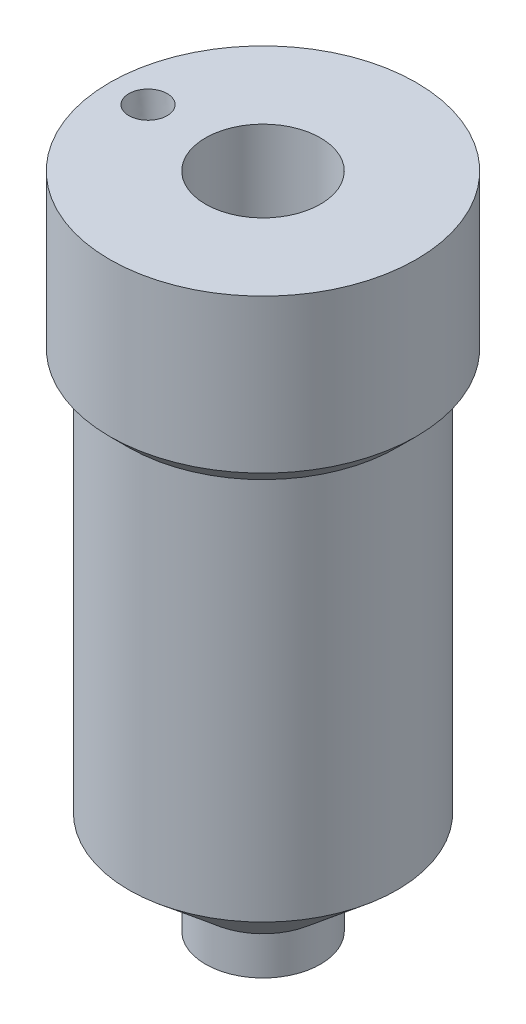
from build123d import *

# Parameters (mm, degrees)
SKETCH3_R         = 1
SKETCH8_W         = 0.07
SKETCH8_H         = 0.35
CIRPATTERN2_COUNT = 14
CIRPATTERN3_COUNT = 12
CIRPATTERN4_COUNT = 6


with BuildPart() as part:
    # Sketch1 → Revolve1 (revolve)
    with BuildSketch(Plane.XY, mode=Mode.PRIVATE) as revolve1_sk:
        with BuildLine():
            Line((3, -1.968555634), (3, 21.031444366))
            Line((3, 21.031444366), (8, 21.031444366))
            Line((8, 21.031444366), (8, 13.031444366))
            Line((8, 13.031444366), (7, 12.031444366))
            Line((7, 12.031444366), (7, -7.968555634))
            Line((7, -7.968555634), (3, -11.324954159))
            Line((3, -11.324954159), (3, -13.324954159))
            Line((3, -13.324954159), (0.5, -14.768329832))
            Line((0.5, -14.768329832), (0.5, -9.868329832))
            ThreePointArc((0.5, -9.868329832), (0.652240935, -9.102962967), (1.085786438, -8.454116269))
            add(Edge.make_bspline(
                [(1.085786438, -8.454116269), (5.800555296, -3.73934741), (7.549181555, -1.968555634), (3, -1.968555634)],
                knots=[0.03799373, 0.03799373, 0.03799373, 0.03799373, 1, 1, 1, 1], degree=3))
        make_face()
    revolve(revolve1_sk.sketch.rotate(Axis((0, 26.545479362, 0), (0, -1, 0)), 90), axis=Axis((0, 26.545479362, 0), (0, -1, 0)))

    # Cut-Sweep1: sweep along a path in Sketch2
    with BuildLine(Plane.XY) as cut_sweep1_path:
        Line((-6, 21.031444366), (-4.6, -2.971908367))
    # Sketch3 → Cut-Sweep1 (sweep, cut)
    with BuildSketch(Plane(origin=(0, 21.031444366, 0), x_dir=(1, 0, 0), z_dir=(0, 1, 0))):
        with Locations((-6, 0)):
            Circle(SKETCH3_R)
    sweep(path=cut_sweep1_path.line, mode=Mode.SUBTRACT)

    # Sketch4 → Revolve2 (revolve)
    with BuildSketch(Plane.XY, mode=Mode.PRIVATE) as revolve2_sk:
        with BuildLine():
            ThreePointArc((0, -15.168329832), (0.282842712, -15.051172544), (0.4, -14.768329832))
            Line((0.4, -14.768329832), (0.5, -14.668329832))
            Line((0.5, -14.668329832), (0.5, -14.768329832))
            ThreePointArc((0.5, -14.768329832), (0.353553391, -15.121883222), (0, -15.268329832))
            Line((0, -15.268329832), (0, -15.168329832))
        make_face()
    revolve(revolve2_sk.sketch.rotate(Axis((0, -14.768329832, 0), (0, -1, 0)), 90), axis=Axis((0, -14.768329832, 0), (0, -1, 0)))

    # Sketch5 → Cut-Revolve2 (revolve, cut)
    with BuildSketch(Plane.XY, mode=Mode.PRIVATE) as cut_revolve2_sk:
        Polygon((-0.341224769, -14.846212159), (-0.682449539, -14.924094485), (-0.666873073, -14.992339439), (-0.325648304, -14.914457112), align=None)
    cut_revolve2 = revolve(cut_revolve2_sk.sketch.rotate(Axis((-0.341224769, -14.846212159, 0), (-0.9749279121818248, -0.22252093395630929, 0)), 180), axis=Axis((-0.341224769, -14.846212159, 0), (-0.9749279121818248, -0.22252093395630929, 0)), mode=Mode.SUBTRACT)

    # Sketch6 → Cut-Revolve3 (revolve, cut)
    with BuildSketch(Plane.XY, mode=Mode.PRIVATE) as cut_revolve3_sk:
        Polygon((-0.547282038, -15.204772693), (-0.503637752, -15.259500897), (-0.229996733, -15.041279466), (-0.273641019, -14.986551262), align=None)
    cut_revolve3 = revolve(cut_revolve3_sk.sketch.rotate(Axis((-0.273641019, -14.986551262, 0), (-0.781831482468034, -0.6234898018587284, 0)), 180), axis=Axis((-0.273641019, -14.986551262, 0), (-0.781831482468034, -0.6234898018587284, 0)), mode=Mode.SUBTRACT)

    # Sketch7 → Cut-Revolve4 (revolve, cut)
    with BuildSketch(Plane.XY, mode=Mode.PRIVATE) as cut_revolve4_sk:
        Polygon((-0.303718617, -15.399008039), (-0.240650797, -15.429379901), (-0.088791488, -15.114040797), (-0.151859309, -15.083668935), align=None)
    cut_revolve4 = revolve(cut_revolve4_sk.sketch.rotate(Axis((-0.151859309, -15.083668935, 0), (-0.43388373911756084, -0.9009688679024179, 0)), 180), axis=Axis((-0.151859309, -15.083668935, 0), (-0.43388373911756084, -0.9009688679024179, 0)), mode=Mode.SUBTRACT)

    # Sketch8 → Cut-Revolve5 (revolve, cut)
    with BuildSketch(Plane.XY, mode=Mode.PRIVATE) as cut_revolve5_sk:
        with Locations((0.035, -15.293329832)):
            Rectangle(SKETCH8_W, SKETCH8_H)
    revolve(cut_revolve5_sk.sketch.rotate(Axis((0, -15.118329832, 0), (0, -1, 0)), 90), axis=Axis((0, -15.118329832, 0), (0, -1, 0)), mode=Mode.SUBTRACT)

    # CirPattern2: Cut-Revolve2 ×14 about axis
    cirpattern2_axis = Axis((0, -14.668329832, 0), (0, 1, 0))
    for i in range(1, CIRPATTERN2_COUNT):
        add(cut_revolve2.rotate(cirpattern2_axis, i * 360 / CIRPATTERN2_COUNT), mode=Mode.SUBTRACT)

    # CirPattern3: Cut-Revolve3 ×12 about axis
    cirpattern3_axis = Axis((0, -14.668329832, 0), (0, 1, 0))
    for i in range(1, CIRPATTERN3_COUNT):
        add(cut_revolve3.rotate(cirpattern3_axis, i * 360 / CIRPATTERN3_COUNT), mode=Mode.SUBTRACT)

    # CirPattern4: Cut-Revolve4 ×6 about axis
    cirpattern4_axis = Axis((0, -14.668329832, 0), (0, 1, 0))
    for i in range(1, CIRPATTERN4_COUNT):
        add(cut_revolve4.rotate(cirpattern4_axis, i * 360 / CIRPATTERN4_COUNT), mode=Mode.SUBTRACT)


solid = part.part
